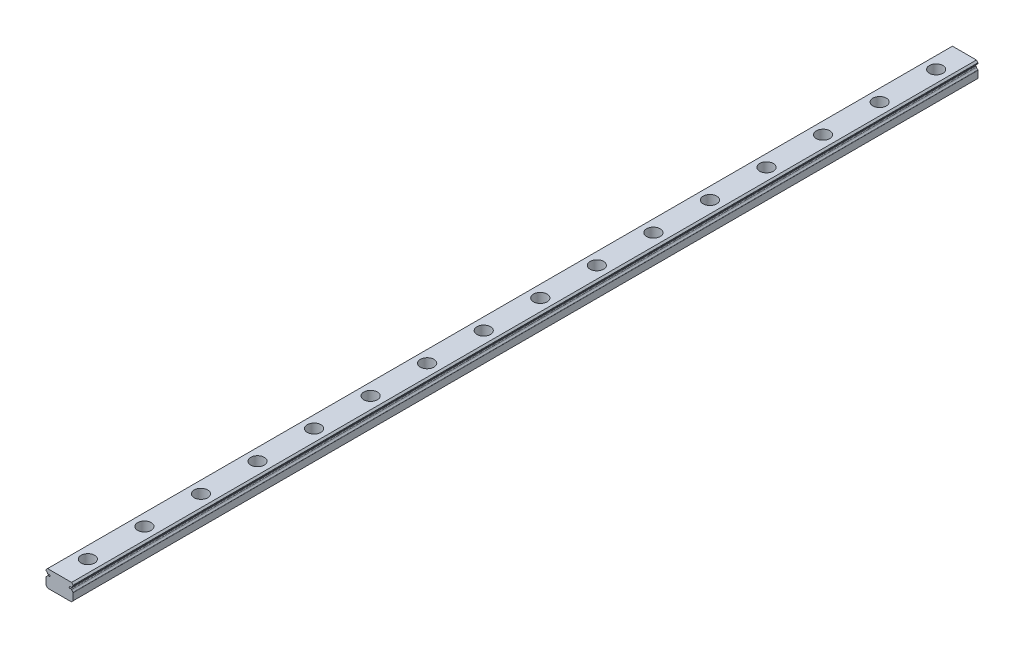
from build123d import *

# Parameters (mm, degrees)
SKETCH4_W                                           = 12
SKETCH4_H                                           = 7.5
BOSS_EXTRUDE1_DEPTH                                 = 400
CUT_EXTRUDE1_DEPTH                                  = 401.115295884
FILLET1_R                                           = 0.2
CHAMFER1_SIZE                                       = 0.7
CHAMFER2_SIZE                                       = 0.8
CBORE_FOR_M3_HEX_SOCKET_HEAD_CAP_SCREW1_D           = 3.5
CBORE_FOR_M3_HEX_SOCKET_HEAD_CAP_SCREW1_CBORE_D     = 6
CBORE_FOR_M3_HEX_SOCKET_HEAD_CAP_SCREW1_CBORE_DEPTH = 4.4
LPATTERN1_COUNT                                     = 16
LPATTERN1_PITCH                                     = 25


with BuildPart() as part:
    # Sketch4 → Boss-Extrude1 (new body)
    with BuildSketch(Plane.XY):
        with Locations((0, -3.75)):
            Rectangle(SKETCH4_W, SKETCH4_H)
    extrude(amount=BOSS_EXTRUDE1_DEPTH)

    # Sketch5 → Cut-Extrude1 (cut, through all)
    with BuildSketch(Plane.XY):
        with BuildLine():
            ThreePointArc((-5.329252402, -1.887480513), (-7.9134, -2.3), (-5.329252402, -2.712519487))
            ThreePointArc((-5.329252402, -2.712519487), (-5.158134449, -2.549348252), (-4.927570698, -2.601755909))
            ThreePointArc((-4.927570698, -2.601755909), (-4.265, -2.3), (-4.927570698, -1.998244091))
            ThreePointArc((-4.927570698, -1.998244091), (-5.158134449, -2.050651748), (-5.329252402, -1.887480513))
        make_face()
    cut_extrude1 = extrude(amount=CUT_EXTRUDE1_DEPTH, mode=Mode.SUBTRACT)

    # Mirror3: Cut-Extrude1 across plane
    add(cut_extrude1.mirror(Plane(origin=(0, 0, 0), x_dir=(0, 0, 1), z_dir=(1, 0, 0))), mode=Mode.SUBTRACT)

    # Fillet1
    fillet1_edges = [part.edges().sort_by_distance(p)[0] for p in [
        (-6, -3.487185933, 200),
        (-6, -1.112814067, 200),
        (6, -1.112814067, 200),
        (6, -3.487185933, 200),
    ]]
    fillet(fillet1_edges, radius=FILLET1_R)

    # Chamfer1
    chamfer1_edges = [part.edges().sort_by_distance(p)[0] for p in [
        (-6, 0, 200),
        (6, 0, 200),
    ]]
    chamfer(chamfer1_edges, length=CHAMFER1_SIZE)

    # Chamfer2
    chamfer2_edges = [part.edges().sort_by_distance(p)[0] for p in [
        (6, -7.5, 200),
        (-6, -7.5, 200),
    ]]
    chamfer(chamfer2_edges, length=CHAMFER2_SIZE)

    # CBORE for M3 Hex Socket Head Cap Screw1 (through all)
    with Locations(Plane(origin=(0, 0, 0), x_dir=(1, 0, 0), z_dir=(0, 1, 0))):
        with Locations((0, -12.5)):
            cbore_for_m3_hex_socket_head_cap_screw1 = CounterBoreHole(CBORE_FOR_M3_HEX_SOCKET_HEAD_CAP_SCREW1_D / 2, CBORE_FOR_M3_HEX_SOCKET_HEAD_CAP_SCREW1_CBORE_D / 2, CBORE_FOR_M3_HEX_SOCKET_HEAD_CAP_SCREW1_CBORE_DEPTH)

    # LPattern1: CBORE for M3 Hex Socket Head Cap Screw1 ×16
    with Locations(*[(0, 0, i * LPATTERN1_PITCH) for i in range(1, LPATTERN1_COUNT)]):
        add(cbore_for_m3_hex_socket_head_cap_screw1, mode=Mode.SUBTRACT)


solid = part.part
